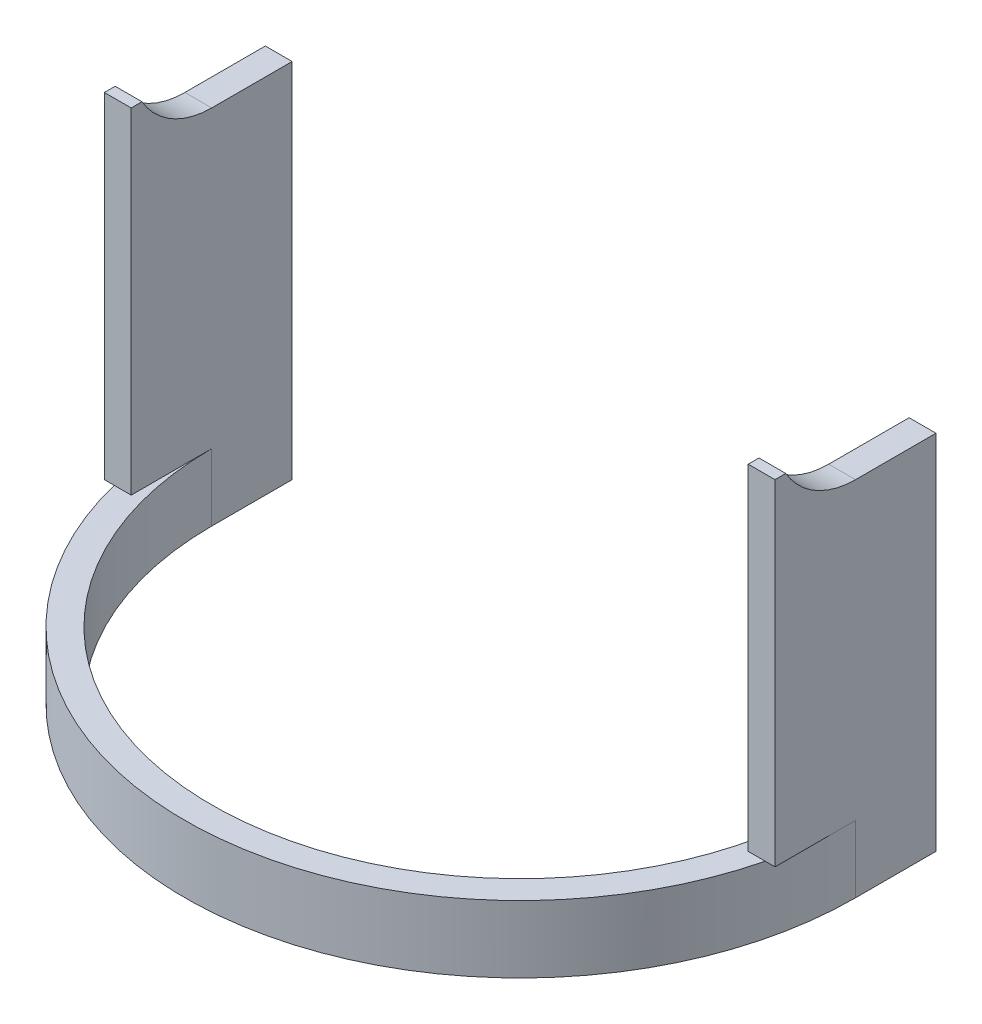
from build123d import *

# Parameters (mm, degrees)
EXTRUDE_1_DEPTH     = 10
SKETCH_2_W          = 4
SKETCH_2_H          = 24
EXTRUDE_2_DEPTH     = 50
CUT_EXTRUDE_3_DEPTH = 127.885775404


with BuildPart() as part:
    # 草图1 → 凸台-拉伸1 (new body)
    with BuildSketch(Plane(origin=(0, 0, 0), x_dir=(1, 0, 0), z_dir=(0, 1, 0))):
        with BuildLine():
            Line((-50, 12), (-46, 12))
            Line((-46, 12), (-46, 0))
            ThreePointArc((-46, 0), (0, -46), (46, 0))
            Line((46, 0), (46, 12))
            Line((46, 12), (50, 12))
            Line((50, 12), (50, 0))
            ThreePointArc((50, 0), (0, -50), (-50, 0))
            Line((-50, 0), (-50, 12))
        make_face()
    extrude(amount=EXTRUDE_1_DEPTH)

    # 草图2 → 凸台-拉伸2 (add)
    with BuildSketch(Plane(origin=(0, 10, 0), x_dir=(1, 0, 0), z_dir=(0, 1, 0))):
        with Locations((-48, 0)):
            Rectangle(SKETCH_2_W, SKETCH_2_H)
        with Locations((48, 0)):
            Rectangle(SKETCH_2_W, SKETCH_2_H)
    extrude(amount=EXTRUDE_2_DEPTH)

    # 草图3 → 切除-拉伸3 (cut, through all)
    with BuildSketch(Plane(origin=(50, 0, 0), x_dir=(0, 0, -1), z_dir=(1, 0, 0))):
        with BuildLine():
            Line((0, 54), (12, 54))
            Line((12, 54), (12, 66))
            ThreePointArc((12, 66), (-8.485281374, 74.485281374), (0, 54))
        make_face()
    extrude(amount=-CUT_EXTRUDE_3_DEPTH, mode=Mode.SUBTRACT)


solid = part.part
